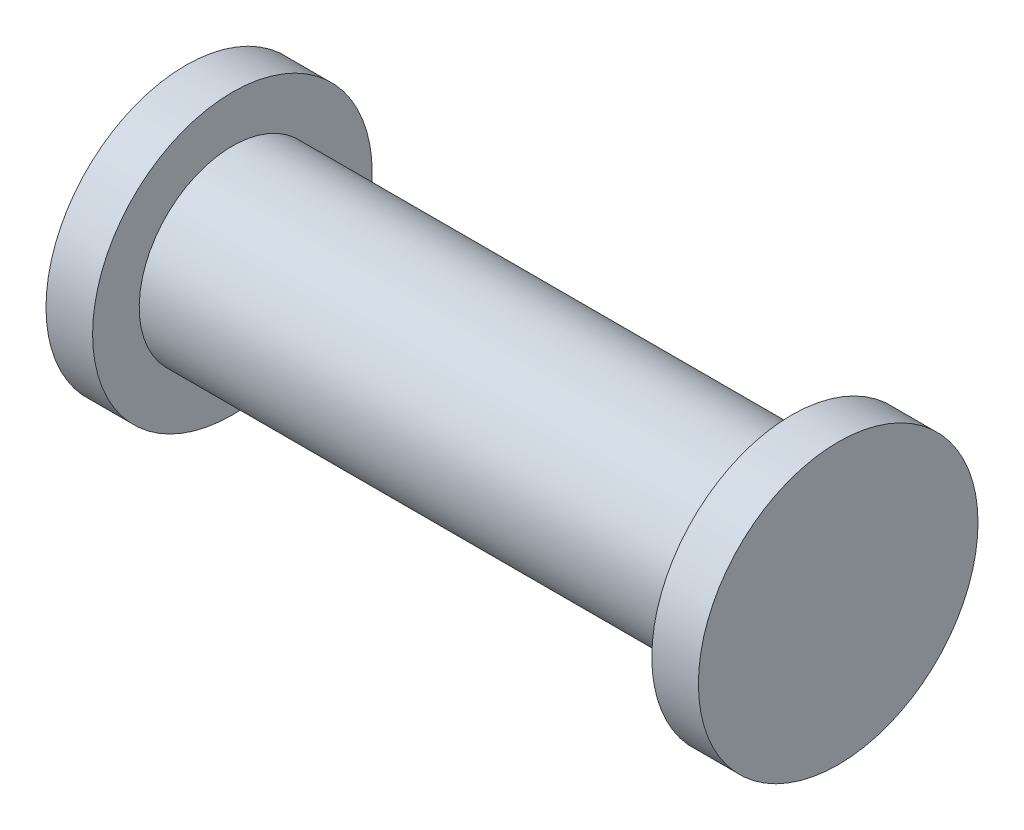
from build123d import *


with BuildPart() as part:
    # Szkic1 → Obrót1 (revolve)
    with BuildSketch(Plane.XY, mode=Mode.PRIVATE) as obr_t1_sk:
        Polygon((0, 0), (6.5, 0), (7, 0), (7, 1.5), (6.5, 1.5), (6.5, 1), (0.5, 1), (0.5, 1.5), (0, 1.5), align=None)
    revolve(obr_t1_sk.sketch.rotate(Axis((6.5, 0, 0), (1, 0, 0)), 180), axis=Axis((6.5, 0, 0), (1, 0, 0)))


solid = part.part
